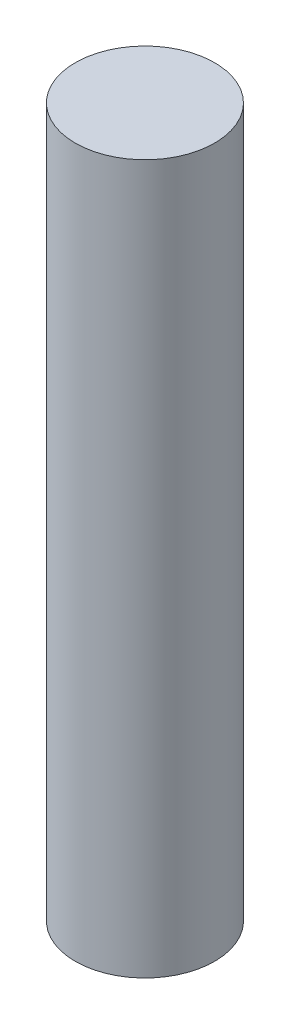
from build123d import *

# Parameters (mm, degrees)
SKETCH1_R           = 2.95
BOSS_EXTRUDE1_DEPTH = 30


with BuildPart() as part:
    # Sketch1 → Boss-Extrude1 (new body)
    with BuildSketch(Plane(origin=(0, 0, 0), x_dir=(1, 0, 0), z_dir=(0, 1, 0))):
        Circle(SKETCH1_R)
    extrude(amount=BOSS_EXTRUDE1_DEPTH)


solid = part.part
